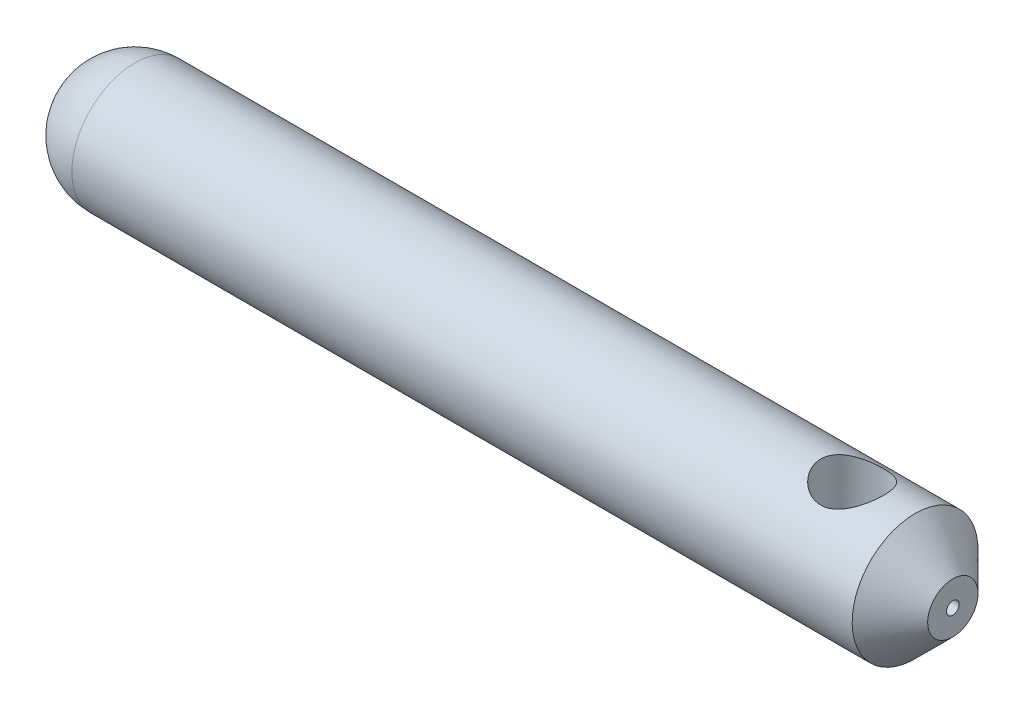
from build123d import *

# Parameters (mm, degrees)
SKETCH4_R               = 0.5
CUT_EXTRUDE1_DEPTH      = 60
CUT_EXTRUDE2_DEPTH      = 65.078926224
CUT_EXTRUDE2_DEPTH_BACK = 65.078926224
SKETCH5_R               = 2.5


with BuildPart() as part:
    # Sketch3 → Revolve1 (revolve)
    with BuildSketch(Plane.XY):
        with BuildLine():
            Line((-1.903971709, 4.611227449), (60.096028291, 4.611227449))
            Line((60.096028291, 4.611227449), (63.096028291, 1.611227449))
            Line((63.096028291, 1.611227449), (63.096028291, -0.388772551))
            Line((63.096028291, -0.388772551), (-6.903971709, -0.388772551))
            ThreePointArc((-6.903971709, -0.388772551), (-5.439505615, 3.146761355), (-1.903971709, 4.611227449))
        make_face()
    revolve(axis=Axis((63.096028291, -0.388772551, 0), (-1, 0, 0)))

    # Sketch4 → Cut-Extrude1 (cut)
    with BuildSketch(Plane(origin=(63.096028291, 0, 0), x_dir=(0, 0, -1), z_dir=(1, 0, 0))):
        with Locations(Location((0, -0.388772551, 0), (0, 0, 90))):
            Circle(SKETCH4_R)
    extrude(amount=-CUT_EXTRUDE1_DEPTH, mode=Mode.SUBTRACT)

    # Sketch5 → Cut-Extrude2 (cut, two sides: drawn at the far end of the back side and taken through both)
    with BuildSketch(Plane(origin=(0, 4.611227449, 0), x_dir=(1, 0, 0), z_dir=(0, 1, 0)).offset(-CUT_EXTRUDE2_DEPTH_BACK)):
        with Locations(Location((55.096028291, 0, 0), (0, 0, 180))):
            Circle(SKETCH5_R)
    extrude(amount=CUT_EXTRUDE2_DEPTH + CUT_EXTRUDE2_DEPTH_BACK, mode=Mode.SUBTRACT)


solid = part.part
